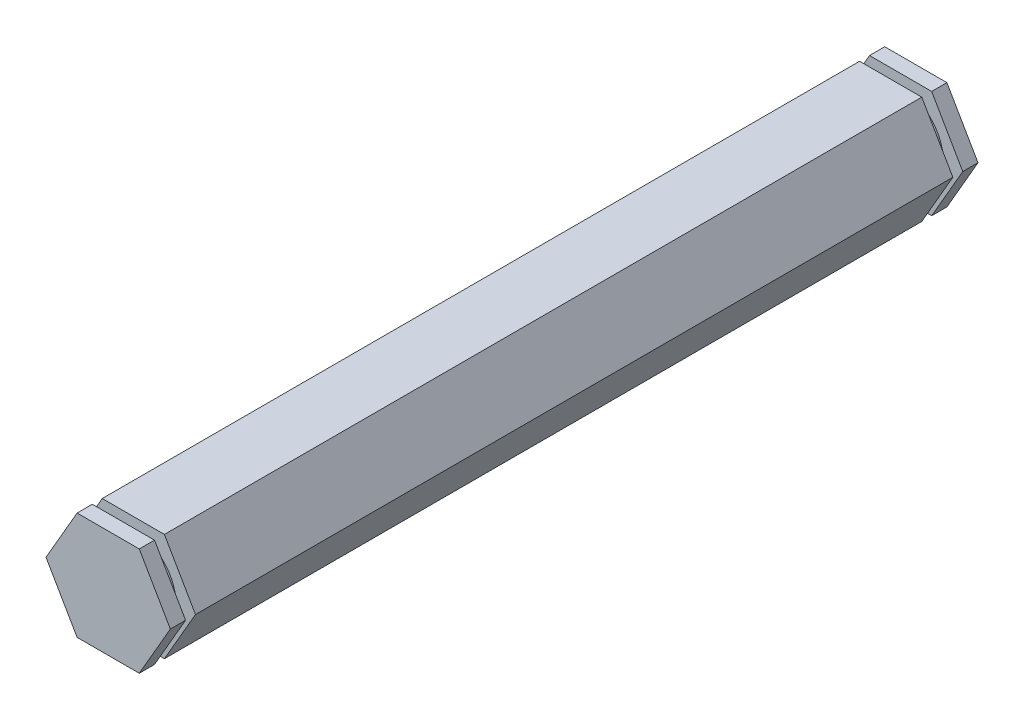
from build123d import *

# Parameters (mm, degrees)
BOSS_EXTRUDE1_DEPTH = 47.625
SKETCH2_W           = 1.1684
SKETCH2_H           = 2.733192613


with BuildPart() as part:
    # Sketch1 → Boss-Extrude1 (new, symmetric)
    with BuildSketch(Plane.XY):
        Polygon((-3.666174209, 6.35), (-7.332348419, 0), (-3.666174209, -6.35), (3.666174209, -6.35), (7.332348419, 0), (3.666174209, 6.35), align=None)
    extrude(amount=BOSS_EXTRUDE1_DEPTH, both=True)

    # Sketch2 → Cut-Revolve1 (revolve, cut)
    with BuildSketch(Plane(origin=(0, 0, 0), x_dir=(0, 0, -1), z_dir=(1, 0, 0))):
        with Locations((-45.24375, 6.395796307)):
            Rectangle(SKETCH2_W, SKETCH2_H)
    cut_revolve1 = revolve(axis=Axis((0, 0, 0), (0, 0, 1)), mode=Mode.SUBTRACT)

    # Mirror1: Cut-Revolve1 across plane
    add(cut_revolve1.mirror(Plane.XY), mode=Mode.SUBTRACT)


solid = part.part
